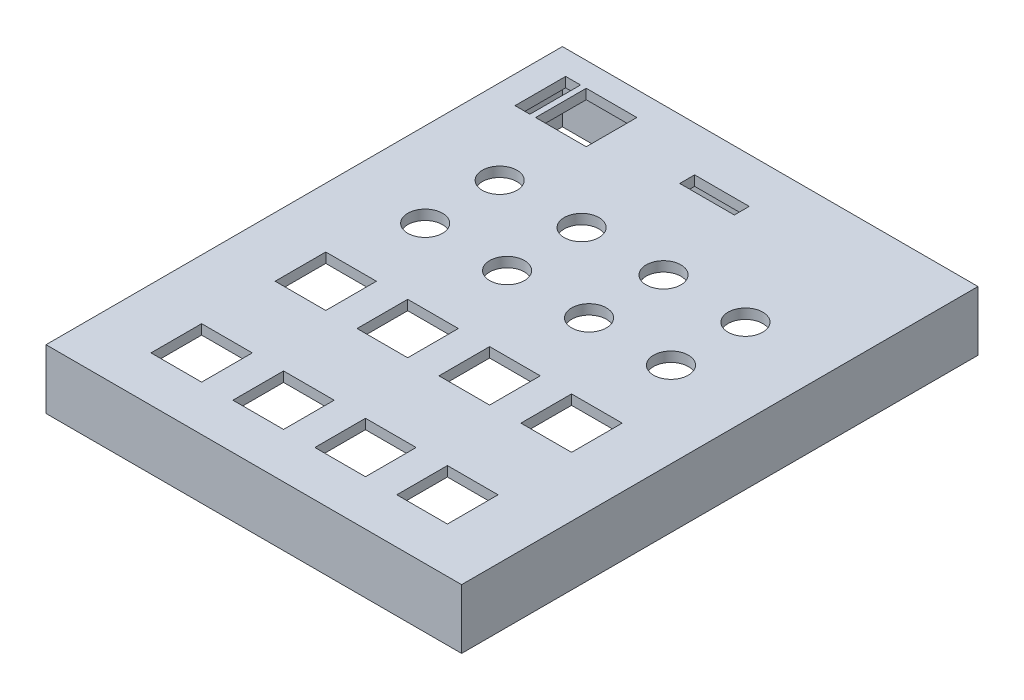
from build123d import *

# Parameters (mm, degrees)
SKETCH1_W                = 79.7
SKETCH1_H                = 100
SKETCH1_R                = 3.5
SKETCH1_W_2              = 10.2
SKETCH1_H_2              = 10.2
SKETCH1_W_3              = 11
SKETCH1_H_3              = 3
SKETCH1_W_4              = 3
BOSS_EXTRUDE1_DEPTH      = 2
BOSS_EXTRUDE2_DEPTH      = 2
BOSS_EXTRUDE2_DEPTH_BACK = 10
SKETCH1_3_W              = 83.7
SKETCH1_3_H              = 104
SKETCH1_3_W_2            = 79.7
SKETCH1_3_H_2            = 100


with BuildPart() as part:
    # Sketch1 → Boss-Extrude1 (new body)
    with BuildSketch(Plane(origin=(0, 0, 0), x_dir=(1, 0, 0), z_dir=(0, 1, 0))):
        with Locations((-77.999694214, 27.678571429)):
            Rectangle(SKETCH1_W, SKETCH1_H)
        with Locations(Location((-102.849694214, 35.042631833, 0), (0, 0, 270))):
            Circle(SKETCH1_R, mode=Mode.SUBTRACT)
        with Locations(Location((-86.349694214, 35.042631833, 0), (0, 0, 270))):
            Circle(SKETCH1_R, mode=Mode.SUBTRACT)
        with Locations(Location((-69.849694214, 35.042631833, 0), (0, 0, 270))):
            Circle(SKETCH1_R, mode=Mode.SUBTRACT)
        with Locations(Location((-53.349694214, 35.042631833, 0), (0, 0, 270))):
            Circle(SKETCH1_R, mode=Mode.SUBTRACT)
        with Locations(Location((-102.849694214, 50.042631833, 0), (0, 0, 270))):
            Circle(SKETCH1_R, mode=Mode.SUBTRACT)
        with Locations(Location((-86.349694214, 50.042631833, 0), (0, 0, 270))):
            Circle(SKETCH1_R, mode=Mode.SUBTRACT)
        with Locations(Location((-69.849694214, 50.042631833, 0), (0, 0, 270))):
            Circle(SKETCH1_R, mode=Mode.SUBTRACT)
        with Locations(Location((-53.349694214, 50.042631833, 0), (0, 0, 270))):
            Circle(SKETCH1_R, mode=Mode.SUBTRACT)
        with Locations((-86.249694214, -10.078571429)):
            Rectangle(SKETCH1_W_2, SKETCH1_H_2, mode=Mode.SUBTRACT)
        with Locations((-102.749694214, -10.078571429)):
            Rectangle(SKETCH1_W_2, SKETCH1_H_2, mode=Mode.SUBTRACT)
        with Locations((-69.749694214, -10.078571429)):
            Rectangle(SKETCH1_W_2, SKETCH1_H_2, mode=Mode.SUBTRACT)
        with Locations((-53.249694214, -10.078571429)):
            Rectangle(SKETCH1_W_2, SKETCH1_H_2, mode=Mode.SUBTRACT)
        with Locations((-86.249694214, 14.921428571)):
            Rectangle(SKETCH1_W_2, SKETCH1_H_2, mode=Mode.SUBTRACT)
        with Locations((-102.749694214, 14.921428571)):
            Rectangle(SKETCH1_W_2, SKETCH1_H_2, mode=Mode.SUBTRACT)
        with Locations((-69.749694214, 14.921428571)):
            Rectangle(SKETCH1_W_2, SKETCH1_H_2, mode=Mode.SUBTRACT)
        with Locations((-53.249694214, 14.921428571)):
            Rectangle(SKETCH1_W_2, SKETCH1_H_2, mode=Mode.SUBTRACT)
        with Locations((-78.657921682, 69.115214956)):
            Rectangle(SKETCH1_W_3, SKETCH1_H_3, mode=Mode.SUBTRACT)
        with Locations((-112.817389032, 69.702349137)):
            Rectangle(SKETCH1_W_4, SKETCH1_H_2, mode=Mode.SUBTRACT)
        with Locations((-105.072966437, 69.702349137)):
            Rectangle(SKETCH1_W_2, SKETCH1_H_2, mode=Mode.SUBTRACT)
    extrude(amount=BOSS_EXTRUDE1_DEPTH)

    # Sketch1<3> → Boss-Extrude2 (add, two sides: drawn at the far end of the back side and taken through both)
    with BuildSketch(Plane(origin=(0, 0, 0), x_dir=(1, 0, 0), z_dir=(0, 1, 0)).offset(-BOSS_EXTRUDE2_DEPTH_BACK)):
        with Locations((-77.999694214, 27.678571429)):
            Rectangle(SKETCH1_3_W, SKETCH1_3_H)
        with Locations((-77.999694214, 27.678571429)):
            Rectangle(SKETCH1_3_W_2, SKETCH1_3_H_2, mode=Mode.SUBTRACT)
    extrude(amount=BOSS_EXTRUDE2_DEPTH + BOSS_EXTRUDE2_DEPTH_BACK)


solid = part.part
